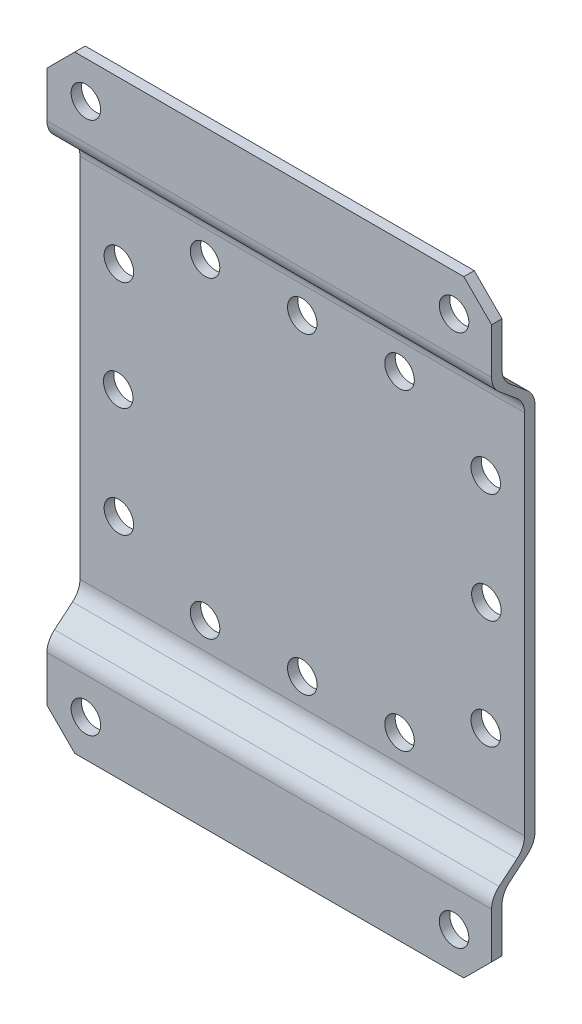
from build123d import *

# Parameters (mm, degrees)
EXTRUDE_1_DEPTH     = 64
CHAMFER_1_SIZE      = 8
SKETCH_4_R          = 4.25
CUT_EXTRUDE_1_DEPTH = 110.073337851
SKETCH_6_R          = 4.25
CUT_EXTRUDE_2_DEPTH = 10


with BuildPart() as part:
    # 草图1 → 凸台-拉伸1 (new, symmetric)
    with BuildSketch(Plane(origin=(0, 0, 0), x_dir=(0, 0, -1), z_dir=(1, 0, 0))):
        with BuildLine():
            Line((0, 87.434221161), (3, 87.434221161))
            Line((3, 87.434221161), (3, 66.740486184))
            ThreePointArc((3, 66.740486184), (3.565077878, 64.198514208), (5.153873841, 62.135346276))
            Line((5.153873841, 62.135346276), (10.346126159, 57.798874885))
            ThreePointArc((10.346126159, 57.798874885), (11.934922122, 55.735706953), (12.5, 53.193734977))
            Line((12.5, 53.193734977), (12.5, -53.193734977))
            ThreePointArc((12.5, -53.193734977), (11.934922122, -55.735706953), (10.346126159, -57.798874885))
            Line((10.346126159, -57.798874885), (5.153873841, -62.135346276))
            ThreePointArc((5.153873841, -62.135346276), (3.565077878, -64.198514208), (3, -66.740486184))
            Line((3, -66.740486184), (3, -87.434221161))
            Line((3, -87.434221161), (0, -87.434221161))
            Line((0, -87.434221161), (0, -66.285275099))
            ThreePointArc((0, -66.285275099), (0.565077878, -63.743303123), (2.153873841, -61.680135191))
            Line((2.153873841, -61.680135191), (7.346126159, -57.3436638))
            ThreePointArc((7.346126159, -57.3436638), (8.934922122, -55.280495868), (9.5, -52.738523893))
            Line((9.5, -52.738523893), (9.5, 52.738523893))
            ThreePointArc((9.5, 52.738523893), (8.934922122, 55.280495868), (7.346126159, 57.3436638))
            Line((7.346126159, 57.3436638), (2.153873841, 61.680135191))
            ThreePointArc((2.153873841, 61.680135191), (0.565077878, 63.743303123), (0, 66.285275099))
            Line((0, 66.285275099), (0, 87.434221161))
        make_face()
    extrude(amount=EXTRUDE_1_DEPTH, both=True)

    # 倒角1
    chamfer_1_edges = [part.edges().sort_by_distance(p)[0] for p in [
        (-64, 87.434221161, -1.5),
        (-64, -87.434221161, -1.5),
        (64, -87.434221161, -1.5),
        (64, 87.434221161, -1.5),
    ]]
    chamfer(chamfer_1_edges, length=CHAMFER_1_SIZE)

    # 草图4 → 切除-拉伸1 (cut, through all)
    with BuildSketch(Plane.XY):
        with Locations((-52.800881805, 76.743624005)):
            Circle(SKETCH_4_R)
        with Locations((53.199118195, 76.743624005)):
            Circle(SKETCH_4_R)
        with Locations((-52.800881805, 31.5)):
            Circle(SKETCH_4_R)
        with Locations((-28, 45)):
            Circle(SKETCH_4_R)
        with Locations((0, 45)):
            Circle(SKETCH_4_R)
        with Locations(Location((52.800881805, 31.5, 0), (0, 0, 180))):
            Circle(SKETCH_4_R)
        with Locations(Location((28, 45, 0), (0, 0, 180))):
            Circle(SKETCH_4_R)
        with Locations(Location((53.199118195, -76.743624005, 0), (0, 0, 270))):
            Circle(SKETCH_4_R)
        with Locations((52.800881805, -31.5)):
            Circle(SKETCH_4_R)
        with Locations((28, -45)):
            Circle(SKETCH_4_R)
        with Locations(Location((0, -45, 0), (0, 0, 180))):
            Circle(SKETCH_4_R)
        with Locations(Location((-28, -45, 0), (0, 0, 180))):
            Circle(SKETCH_4_R)
        with Locations(Location((-52.800881805, -31.5, 0), (0, 0, 180))):
            Circle(SKETCH_4_R)
        with Locations(Location((-52.800881805, -76.743624005, 0), (0, 0, 270))):
            Circle(SKETCH_4_R)
    extrude(amount=-CUT_EXTRUDE_1_DEPTH, mode=Mode.SUBTRACT)

    # 草图6 → 切除-拉伸2 (cut)
    with BuildSketch(Plane(origin=(0, 0, -12.5), x_dir=(-1, 0, 0), z_dir=(0, 0, -1))):
        with Locations((-53, 0)):
            Circle(SKETCH_6_R)
        with Locations((53, 0)):
            Circle(SKETCH_6_R)
    extrude(amount=-CUT_EXTRUDE_2_DEPTH, mode=Mode.SUBTRACT)


solid = part.part
